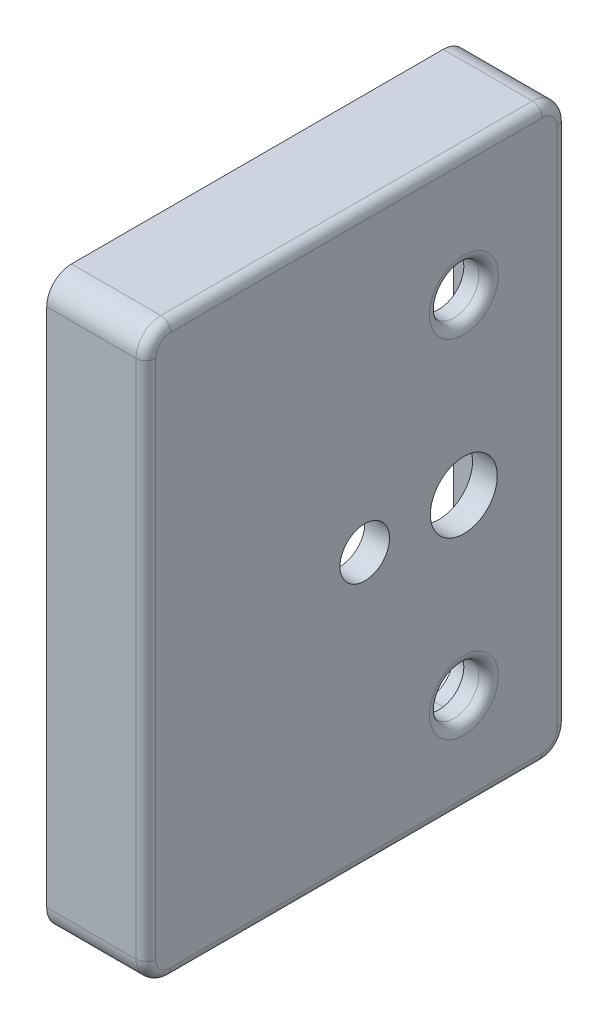
from build123d import *

# Parameters (mm, degrees)
SKETCH1_W           = 43.18
SKETCH1_H           = 58.42
BOSS_EXTRUDE1_DEPTH = 10.16
SKETCH2_R           = 2.54
SKETCH2_R_2         = 3.429
CUT_EXTRUDE2_DEPTH  = 66.806860754
SKETCH3_W           = 37.132
SKETCH3_H           = 52.324
CUT_EXTRUDE3_DEPTH  = 7.62
SKETCH4_W           = 40.18
SKETCH4_H           = 55.372
CUT_EXTRUDE4_DEPTH  = 3.81
FILLET1_R           = 2.54
FILLET2_R           = 2.54
FILLET3_R           = 2.54
FILLET4_R           = 2.54
FILLET5_R           = 2.54
FILLET6_R           = 1
FILLET7_R           = 1
FILLET8_R           = 1


with BuildPart() as part:
    # Sketch1 → Boss-Extrude1 (new body)
    with BuildSketch(Plane(origin=(0, 0, 0), x_dir=(0, 0, -1), z_dir=(1, 0, 0))):
        with Locations((6.948060942, 29.21)):
            Rectangle(SKETCH1_W, SKETCH1_H)
    extrude(amount=BOSS_EXTRUDE1_DEPTH)

    # Sketch2 → Cut-Extrude2 (cut, through all)
    with BuildSketch(Plane.ZY):
        with Locations((-17.960793947, 10.16)):
            Circle(SKETCH2_R)
        with Locations((-17.960793947, 45.72)):
            Circle(SKETCH2_R)
        with Locations((-17.960793947, 27.94)):
            Circle(SKETCH2_R_2)
        with Locations((-7.800793947, 27.94)):
            Circle(SKETCH2_R)
    extrude(amount=-CUT_EXTRUDE2_DEPTH, mode=Mode.SUBTRACT)

    # Sketch3 → Cut-Extrude3 (cut)
    with BuildSketch(Plane.ZY):
        with Locations((-6.972060942, 29.21)):
            Rectangle(SKETCH3_W, SKETCH3_H)
    extrude(amount=-CUT_EXTRUDE3_DEPTH, mode=Mode.SUBTRACT)

    # Sketch4 → Cut-Extrude4 (cut)
    with BuildSketch(Plane.ZY):
        with Locations((-6.972060942, 29.21)):
            Rectangle(SKETCH4_W, SKETCH4_H)
    extrude(amount=-CUT_EXTRUDE4_DEPTH, mode=Mode.SUBTRACT)

    # Fillet1
    fillet1_edges = [part.edges().sort_by_distance(p)[0] for p in [
        (5.715, 3.048, -25.538060942),
        (1.905, 1.524, -27.062060942),
    ]]
    fillet(fillet1_edges, radius=FILLET1_R)

    # Fillet2
    fillet2_edges = [part.edges().sort_by_distance(p)[0] for p in [
        (5.715, 3.048, 11.593939058),
        (1.905, 1.524, 13.117939058),
    ]]
    fillet(fillet2_edges, radius=FILLET2_R)

    # Fillet3
    fillet3_edges = [part.edges().sort_by_distance(p)[0] for p in [
        (5.715, 55.372, 11.593939058),
        (1.905, 56.896, 13.117939058),
    ]]
    fillet(fillet3_edges, radius=FILLET3_R)

    # Fillet4
    fillet4_edges = [part.edges().sort_by_distance(p)[0] for p in [
        (5.715, 55.372, -25.538060942),
        (1.905, 56.896, -27.062060942),
    ]]
    fillet(fillet4_edges, radius=FILLET4_R)

    # Fillet5
    fillet5_edges = [part.edges().sort_by_distance(p)[0] for p in [
        (5.08, 58.42, 14.641939058),
        (5.08, 58.42, -28.538060942),
        (5.08, 0, -28.538060942),
        (5.08, 0, 14.641939058),
    ]]
    fillet(fillet5_edges, radius=FILLET5_R)

    # Fillet6
    fillet6_edges = [part.edges().sort_by_distance(p)[0] for p in [
        (10.16, 29.21, -28.538060942),
        (10.16, 0, -6.948060942),
        (10.16, 29.21, 14.641939058),
        (10.16, 58.42, -6.948060942),
        (10.16, 57.676051224, 13.897990282),
        (10.16, 57.676051224, -27.794112166),
        (10.16, 0.743948776, 13.897990282),
        (10.16, 0.743948776, -27.794112166),
    ]]
    fillet(fillet6_edges, radius=FILLET6_R)

    # Fillet7
    fillet7_edges = [part.edges().sort_by_distance(p)[0] for p in [
        (10.16, 45.72, -20.500793947),
    ]]
    fillet(fillet7_edges, radius=FILLET7_R)

    # Fillet8
    fillet8_edges = [part.edges().sort_by_distance(p)[0] for p in [
        (10.16, 10.16, -20.500793947),
    ]]
    fillet(fillet8_edges, radius=FILLET8_R)


solid = part.part
